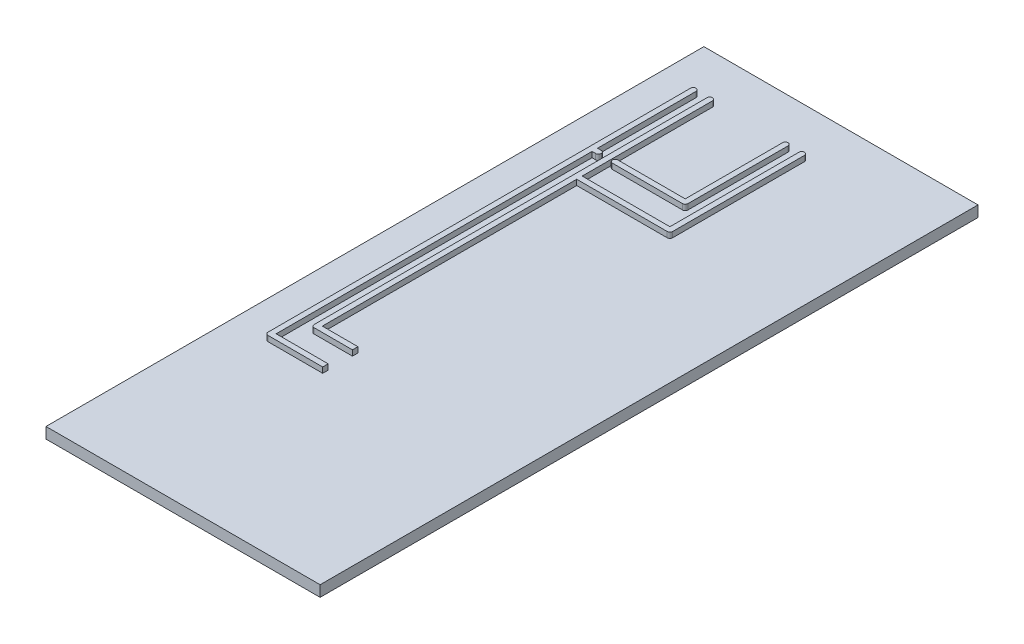
from build123d import *

# Parameters (mm, degrees)
SKETCH1_W           = 50
SKETCH1_H           = 120
BOSS_EXTRUDE1_DEPTH = 2
SKETCH2_W           = 0.5
SKETCH2_H           = 5.295420769
SKETCH2_H_2         = 23.549654675
BOSS_EXTRUDE3_DEPTH = 1


with BuildPart() as part:
    # Sketch1 → Boss-Extrude1 (new body)
    with BuildSketch(Plane(origin=(0, 0, 0), x_dir=(1, 0, 0), z_dir=(0, 1, 0))):
        with Locations((25, 60)):
            Rectangle(SKETCH1_W, SKETCH1_H)
    extrude(amount=BOSS_EXTRUDE1_DEPTH)

    # Sketch2 → Boss-Extrude3 (add)
    with BuildSketch(Plane(origin=(0, 2, 0), x_dir=(1, 0, 0), z_dir=(0, 1, 0))):
        with BuildLine():
            Line((9.849958258, 39.051579924), (16.845127039, 39.051579924))
            Line((16.845127039, 39.051579924), (16.845127039, 40.051579924))
            Line((16.845127039, 40.051579924), (10.349958258, 40.051579924))
            Line((10.349958258, 40.051579924), (10.349958258, 39.551579924))
            ThreePointArc((10.349958258, 39.551579924), (10.203511648, 39.198026534), (9.849958258, 39.051579924))
        make_face()
        with BuildLine():
            Line((10.349958258, 40.051579924), (10.349958258, 86.455511816))
            Line((10.349958258, 86.455511816), (9.849958258, 86.455511816))
            ThreePointArc((9.849958258, 86.455511816), (9.496404867, 86.601958426), (9.349958258, 86.955511816))
            Line((9.349958258, 86.955511816), (9.349958258, 39.551579924))
            ThreePointArc((9.349958258, 39.551579924), (9.496404867, 39.198026534), (9.849958258, 39.051579924))
            ThreePointArc((9.849958258, 39.051579924), (10.203511648, 39.198026534), (10.349958258, 39.551579924))
            Line((10.349958258, 39.551579924), (10.349958258, 40.051579924))
        make_face()
        with BuildLine():
            Line((6.849958258, 33.630782095), (16.845127039, 33.630782095))
            Line((16.845127039, 33.630782095), (16.845127039, 34.630782095))
            Line((16.845127039, 34.630782095), (7.349958258, 34.630782095))
            Line((7.349958258, 34.630782095), (7.349958258, 92.250932585))
            Line((7.349958258, 92.250932585), (8.019263959, 92.250932585))
            ThreePointArc((8.019263959, 92.250932585), (8.37281735, 92.397379194), (8.519263959, 92.750932585))
            ThreePointArc((8.519263959, 92.750932585), (8.37281735, 93.104485976), (8.019263959, 93.250932585))
            Line((8.019263959, 93.250932585), (7.349958258, 93.250932585))
            Line((7.349958258, 93.250932585), (7.349958258, 111.215314398))
            ThreePointArc((7.349958258, 111.215314398), (7.203511648, 111.568867789), (6.849958258, 111.715314398))
            ThreePointArc((6.849958258, 111.715314398), (6.496404867, 111.568867789), (6.349958258, 111.215314398))
            Line((6.349958258, 111.215314398), (6.349958258, 34.130782095))
            ThreePointArc((6.349958258, 34.130782095), (6.496404867, 33.777228705), (6.849958258, 33.630782095))
        make_face()
        with BuildLine():
            Line((9.849958258, 92.750932585), (10.349958258, 92.750932585))
            Line((10.349958258, 92.750932585), (10.349958258, 111.215314398))
            ThreePointArc((10.349958258, 111.215314398), (10.203511648, 111.568867789), (9.849958258, 111.715314398))
            ThreePointArc((9.849958258, 111.715314398), (9.496404867, 111.568867789), (9.349958258, 111.215314398))
            Line((9.349958258, 111.215314398), (9.349958258, 92.750932585))
            Line((9.349958258, 92.750932585), (9.849958258, 92.750932585))
        make_face()
        with Locations((10.099958258, 90.1032222)):
            Rectangle(SKETCH2_W, SKETCH2_H)
        with BuildLine():
            ThreePointArc((9.349958258, 86.955511816), (9.496404867, 87.309065207), (9.849958258, 87.455511816))
            Line((9.849958258, 87.455511816), (9.849958258, 92.750932585))
            Line((9.849958258, 92.750932585), (9.349958258, 92.750932585))
            Line((9.349958258, 92.750932585), (9.349958258, 86.955511816))
        make_face()
        with BuildLine():
            ThreePointArc((11.055620389, 93.250932585), (10.702066998, 93.104485976), (10.555620389, 92.750932585))
            Line((10.555620389, 92.750932585), (23.349958258, 92.750932585))
            Line((23.349958258, 92.750932585), (23.349958258, 93.250932585))
            Line((23.349958258, 93.250932585), (11.055620389, 93.250932585))
        make_face()
        with BuildLine():
            Line((23.349958258, 92.750932585), (10.555620389, 92.750932585))
            ThreePointArc((10.555620389, 92.750932585), (10.702066998, 92.397379194), (11.055620389, 92.250932585))
            Line((11.055620389, 92.250932585), (23.849958258, 92.250932585))
            ThreePointArc((23.849958258, 92.250932585), (23.496404867, 92.397379194), (23.349958258, 92.750932585))
        make_face()
        with BuildLine():
            Line((10.349958258, 86.455511816), (25, 86.455511816))
            Line((25, 86.455511816), (26.849958258, 86.455511816))
            ThreePointArc((26.849958258, 86.455511816), (26.496404867, 86.601958426), (26.349958258, 86.955511816))
            Line((26.349958258, 86.955511816), (26.349958258, 87.455511816))
            Line((26.349958258, 87.455511816), (25, 87.455511816))
            Line((25, 87.455511816), (10.349958258, 87.455511816))
            Line((10.349958258, 87.455511816), (10.349958258, 86.455511816))
        make_face()
        with BuildLine():
            ThreePointArc((26.349958258, 86.955511816), (26.496404867, 86.601958426), (26.849958258, 86.455511816))
            ThreePointArc((26.849958258, 86.455511816), (27.203511648, 86.601958426), (27.349958258, 86.955511816))
            ThreePointArc((27.349958258, 86.955511816), (27.203511648, 87.309065207), (26.849958258, 87.455511816))
            Line((26.849958258, 87.455511816), (26.349958258, 87.455511816))
            Line((26.349958258, 87.455511816), (26.349958258, 86.955511816))
        make_face()
        with BuildLine():
            ThreePointArc((26.849958258, 87.455511816), (27.203511648, 87.309065207), (27.349958258, 86.955511816))
            Line((27.349958258, 86.955511816), (27.349958258, 111.005166491))
            ThreePointArc((27.349958258, 111.005166491), (26.849958258, 111.505166491), (26.349958258, 111.005166491))
            Line((26.349958258, 111.005166491), (26.849958258, 111.005166491))
            Line((26.849958258, 111.005166491), (26.849958258, 87.455511816))
        make_face()
        with Locations((26.599958258, 99.230339154)):
            Rectangle(SKETCH2_W, SKETCH2_H_2)
        with BuildLine():
            Line((23.849958258, 111.005166491), (23.849958258, 93.250932585))
            ThreePointArc((23.849958258, 93.250932585), (24.203511648, 93.104485976), (24.349958258, 92.750932585))
            Line((24.349958258, 92.750932585), (24.349958258, 111.005166491))
            Line((24.349958258, 111.005166491), (23.849958258, 111.005166491))
        make_face()
        with BuildLine():
            Line((23.349958258, 93.250932585), (23.349958258, 92.750932585))
            ThreePointArc((23.349958258, 92.750932585), (23.496404867, 92.397379194), (23.849958258, 92.250932585))
            ThreePointArc((23.849958258, 92.250932585), (24.203511648, 92.397379194), (24.349958258, 92.750932585))
            ThreePointArc((24.349958258, 92.750932585), (24.203511648, 93.104485976), (23.849958258, 93.250932585))
            Line((23.849958258, 93.250932585), (23.349958258, 93.250932585))
        make_face()
        with BuildLine():
            Line((23.349958258, 111.005166491), (23.349958258, 93.250932585))
            Line((23.349958258, 93.250932585), (23.849958258, 93.250932585))
            Line((23.849958258, 93.250932585), (23.849958258, 111.005166491))
            Line((23.849958258, 111.005166491), (24.349958258, 111.005166491))
            ThreePointArc((24.349958258, 111.005166491), (23.849958258, 111.505166491), (23.349958258, 111.005166491))
        make_face()
        with BuildLine():
            Line((9.849958258, 86.455511816), (10.349958258, 86.455511816))
            Line((10.349958258, 86.455511816), (10.349958258, 87.455511816))
            Line((10.349958258, 87.455511816), (9.849958258, 87.455511816))
            ThreePointArc((9.849958258, 87.455511816), (9.496404867, 87.309065207), (9.349958258, 86.955511816))
            ThreePointArc((9.349958258, 86.955511816), (9.496404867, 86.601958426), (9.849958258, 86.455511816))
        make_face()
    extrude(amount=BOSS_EXTRUDE3_DEPTH)


solid = part.part
